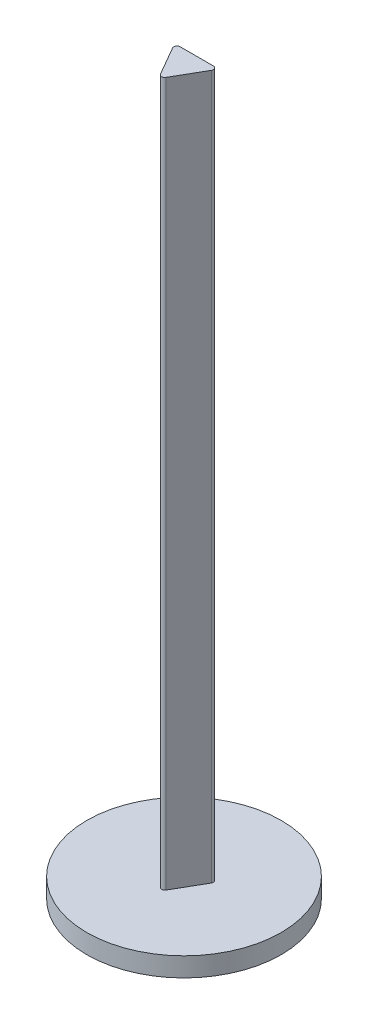
from build123d import *

# Parameters (mm, degrees)
SKETCH1_R           = 15.19
BOSS_EXTRUDE1_DEPTH = 3
BOSS_EXTRUDE2_DEPTH = 110


with BuildPart() as part:
    # Sketch1 → Boss-Extrude1 (new body)
    with BuildSketch(Plane(origin=(0, 0, 0), x_dir=(1, 0, 0), z_dir=(0, 1, 0))):
        with Locations(Location((0, 0, 0), (0, 0, 270))):
            Circle(SKETCH1_R)
    extrude(amount=BOSS_EXTRUDE1_DEPTH)

    # Sketch2 → Boss-Extrude2 (add)
    with BuildSketch(Plane(origin=(0, 3, 0), x_dir=(1, 0, 0), z_dir=(0, 1, 0))):
        with BuildLine():
            Line((0.433012702, -3.25), (3.031088913, 1.25))
            ThreePointArc((3.031088913, 1.25), (3.031088913, 1.75), (2.598076211, 2))
            Line((2.598076211, 2), (-2.598076211, 2))
            ThreePointArc((-2.598076211, 2), (-3.031088913, 1.75), (-3.031088913, 1.25))
            Line((-3.031088913, 1.25), (-0.433012702, -3.25))
            ThreePointArc((-0.433012702, -3.25), (0, -3.5), (0.433012702, -3.25))
        make_face()
    extrude(amount=BOSS_EXTRUDE2_DEPTH)


solid = part.part
